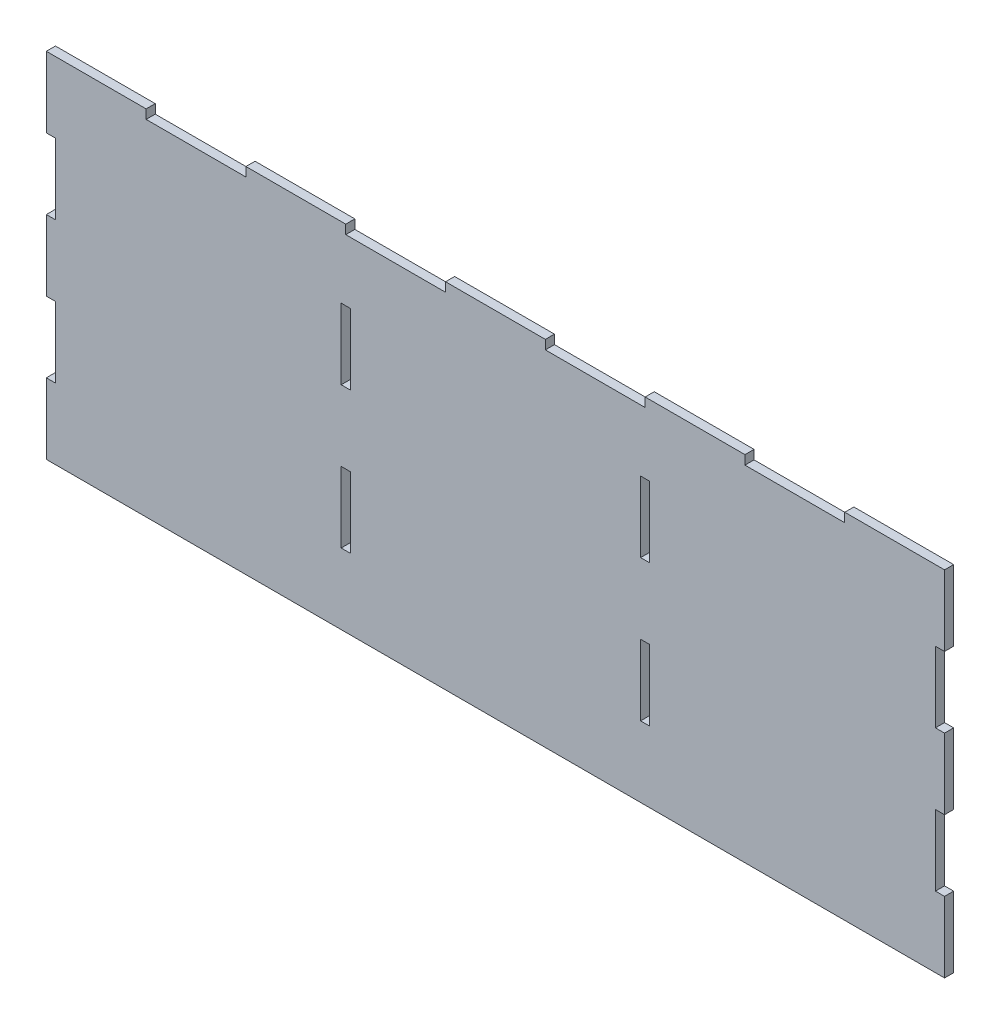
from build123d import *

# Parameters (mm, degrees)
SKETCH1_W           = 3.175
SKETCH1_H           = 24.635
BOSS_EXTRUDE1_DEPTH = 3.175


with BuildPart() as part:
    # Sketch1 → Boss-Extrude1 (new body)
    with BuildSketch(Plane.XY):
        Polygon((0, 0), (313, 0), (313, 24.635), (309.825, 24.635), (309.825, 49.27), (313, 49.27), (313, 73.905), (309.825, 73.905), (309.825, 98.54), (313, 98.54), (313, 123.175), (278.222222222, 123.175), (278.222222222, 120), (243.444444444, 120), (243.444444444, 123.175), (208.666666667, 123.175), (208.666666667, 120), (173.888888889, 120), (173.888888889, 123.175), (139.111111111, 123.175), (139.111111111, 120), (104.333333333, 120), (104.333333333, 123.175), (69.555555556, 123.175), (69.555555556, 120), (34.777777778, 120), (34.777777778, 123.175), (0, 123.175), (0, 98.54), (3.175, 98.54), (3.175, 73.905), (0, 73.905), (0, 49.27), (3.175, 49.27), (3.175, 24.635), (0, 24.635), align=None)
        with Locations((104.333333333, 86.2225)):
            Rectangle(SKETCH1_W, SKETCH1_H, mode=Mode.SUBTRACT)
        with Locations((104.333333333, 36.9525)):
            Rectangle(SKETCH1_W, SKETCH1_H, mode=Mode.SUBTRACT)
        with Locations((208.666666667, 86.2225)):
            Rectangle(SKETCH1_W, SKETCH1_H, mode=Mode.SUBTRACT)
        with Locations((208.666666667, 36.9525)):
            Rectangle(SKETCH1_W, SKETCH1_H, mode=Mode.SUBTRACT)
    extrude(amount=BOSS_EXTRUDE1_DEPTH)


solid = part.part
